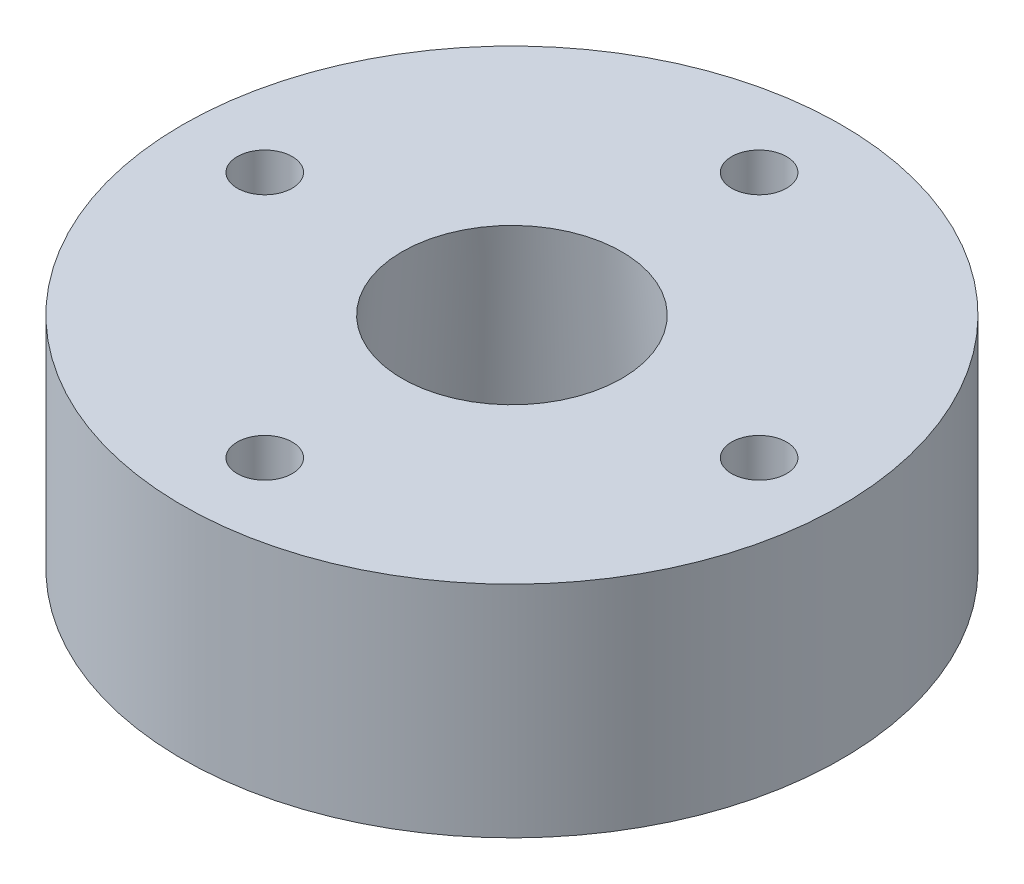
from build123d import *

# Parameters (mm, degrees)
FILLET1_R          = 2
SKETCH3_R          = 3.175
CUT_EXTRUDE1_DEPTH = 74.231772476


with BuildPart() as part:
    # Sketch2 → Revolve2 (revolve)
    with BuildSketch(Plane.XY, mode=Mode.PRIVATE) as revolve2_sk:
        Polygon((19.05, -12.7), (-2.29475363, -12.7), (-2.320408163, -12.7), (-4.320233699, -10.701915819), (-6.35, 12.7), (19.05, 12.7), align=None)
    revolve(revolve2_sk.sketch.rotate(Axis((-19.05, 12.7, 0), (0, -1, 0)), 180), axis=Axis((-19.05, 12.7, 0), (0, -1, 0)))

    # Fillet1
    fillet1_edges = [part.edges().sort_by_distance(p)[0] for p in [
        (-4.320233699, -10.701915819, 0),
        (-2.320408163, -12.7, 0),
    ]]
    fillet(fillet1_edges, radius=FILLET1_R)

    # Sketch3 → Cut-Extrude1 (cut, through all)
    with BuildSketch(Plane(origin=(0, 12.7, 0), x_dir=(1, 0, 0), z_dir=(0, 1, 0))):
        with Locations(Location((-19.05, 28.575, 0), (0, 0, 180))):
            Circle(SKETCH3_R)
        with Locations(Location((9.525, 0, 0), (0, 0, 180))):
            Circle(SKETCH3_R)
        with Locations(Location((-19.05, -28.575, 0), (0, 0, 180))):
            Circle(SKETCH3_R)
        with Locations(Location((-47.625, 0, 0), (0, 0, 180))):
            Circle(SKETCH3_R)
    extrude(amount=-CUT_EXTRUDE1_DEPTH, mode=Mode.SUBTRACT)


solid = part.part
